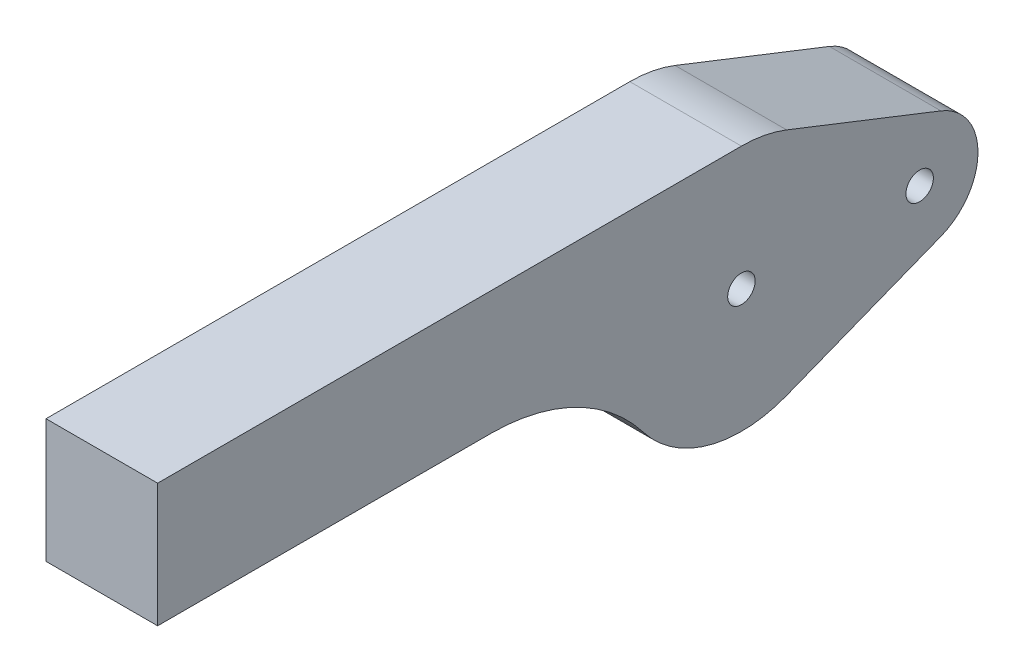
from build123d import *

# Parameters (mm, degrees)
EXTRUDE_1_DEPTH = 8.13
FILLET_1_R      = 14


with BuildPart() as part:
    # 草图1 → 凸台-拉伸1 (new body)
    with BuildSketch(Plane(origin=(0, 0, 0), x_dir=(0, 0, -1), z_dir=(1, 0, 0))):
        with BuildLine():
            Line((-30, 4.725), (4.860079961, 4.725))
            ThreePointArc((4.860079961, 4.725), (8.133942545, 7.858912138), (12.52, 9))
            Line((12.52, 9), (-30, 9))
            Line((-30, 9), (-30, 4.725))
        make_face()
        with BuildLine():
            ThreePointArc((12.52, 9), (8.133942545, 7.858912138), (4.860079961, 4.725))
            Line((4.860079961, 4.725), (20.179920039, 4.725))
            ThreePointArc((20.179920039, 4.725), (18.292906217, 6.904603813), (15.813528505, 8.375719073))
            ThreePointArc((15.813528505, 8.375719073), (14.196085968, 8.842552563), (12.52, 9))
        make_face()
        with BuildLine():
            ThreePointArc((11.52, 0), (12.52, 1), (13.52, 0))
            Line((13.52, 0), (21.25, 0))
            ThreePointArc((21.25, 0), (21.296353514, 0.625984202), (21.434402928, 1.238313549))
            ThreePointArc((21.434402928, 1.238313549), (20.988547163, 3.046917943), (20.179920039, 4.725))
            Line((20.179920039, 4.725), (4.860079961, 4.725))
            ThreePointArc((4.860079961, 4.725), (3.861498965, 2.455679097), (3.52, 0))
            Line((3.52, 0), (11.52, 0))
        make_face()
        with BuildLine():
            ThreePointArc((21.434402928, 1.238313549), (21.498575231, 0.620634213), (21.52, 0))
            Line((21.52, 0), (24.5, 0))
            ThreePointArc((24.5, 0), (25.5, 1), (26.5, 0))
            Line((26.5, 0), (29.75, 0))
            ThreePointArc((29.75, 0), (29.012294744, 2.392965865), (27.05527735, 3.955200673))
            ThreePointArc((27.05527735, 3.955200673), (23.650460817, 3.826448067), (21.434402928, 1.238313549))
        make_face()
        with BuildLine():
            Line((24.5, 0), (21.52, 0))
            ThreePointArc((21.52, 0), (21.498575231, -0.620634213), (21.434402928, -1.238313549))
            ThreePointArc((21.434402928, -1.238313549), (23.650460817, -3.826448067), (27.05527735, -3.955200673))
            ThreePointArc((27.05527735, -3.955200673), (29.012294744, -2.392965865), (29.75, 0))
            Line((29.75, 0), (26.5, 0))
            ThreePointArc((26.5, 0), (25.5, -1), (24.5, 0))
        make_face()
        with BuildLine():
            ThreePointArc((20.179920039, 4.725), (20.988547163, 3.046917943), (21.434402928, 1.238313549))
            ThreePointArc((21.434402928, 1.238313549), (23.650460817, 3.826448067), (27.05527735, 3.955200673))
            Line((27.05527735, 3.955200673), (25.097613132, 4.725))
            Line((25.097613132, 4.725), (20.179920039, 4.725))
        make_face()
        with BuildLine():
            ThreePointArc((15.813528505, 8.375719073), (18.292906217, 6.904603813), (20.179920039, 4.725))
            Line((20.179920039, 4.725), (25.097613132, 4.725))
            Line((25.097613132, 4.725), (15.813528505, 8.375719073))
        make_face()
        with BuildLine():
            Line((-30, 0), (3.52, 0))
            ThreePointArc((3.52, 0), (3.861498965, 2.455679097), (4.860079961, 4.725))
            Line((4.860079961, 4.725), (-30, 4.725))
            Line((-30, 4.725), (-30, 0))
        make_face()
        with BuildLine():
            Line((21.25, 0), (13.52, 0))
            ThreePointArc((13.52, 0), (12.52, -1), (11.52, 0))
            Line((11.52, 0), (3.52, 0))
            ThreePointArc((3.52, 0), (3.861498965, -2.455679097), (4.860079961, -4.725))
            Line((4.860079961, -4.725), (20.179920039, -4.725))
            ThreePointArc((20.179920039, -4.725), (20.988547163, -3.046917943), (21.434402928, -1.238313549))
            ThreePointArc((21.434402928, -1.238313549), (21.296353514, -0.625984202), (21.25, 0))
        make_face()
        with BuildLine():
            Line((20.179920039, -4.725), (4.860079961, -4.725))
            ThreePointArc((4.860079961, -4.725), (9.674252086, -8.538250336), (15.813528505, -8.375719073))
            ThreePointArc((15.813528505, -8.375719073), (18.292906217, -6.904603813), (20.179920039, -4.725))
        make_face()
        with BuildLine():
            ThreePointArc((27.05527735, -3.955200673), (23.650460817, -3.826448067), (21.434402928, -1.238313549))
            ThreePointArc((21.434402928, -1.238313549), (20.988547163, -3.046917943), (20.179920039, -4.725))
            Line((20.179920039, -4.725), (25.097613132, -4.725))
            Line((25.097613132, -4.725), (27.05527735, -3.955200673))
        make_face()
        with BuildLine():
            ThreePointArc((21.434402928, 1.238313549), (21.296353514, 0.625984202), (21.25, 0))
            Line((21.25, 0), (21.52, 0))
            ThreePointArc((21.52, 0), (21.498575231, 0.620634213), (21.434402928, 1.238313549))
        make_face()
        with BuildLine():
            Line((21.52, 0), (21.25, 0))
            ThreePointArc((21.25, 0), (21.296353514, -0.625984202), (21.434402928, -1.238313549))
            ThreePointArc((21.434402928, -1.238313549), (21.498575231, -0.620634213), (21.52, 0))
        make_face()
        with BuildLine():
            Line((25.097613132, -4.725), (20.179920039, -4.725))
            ThreePointArc((20.179920039, -4.725), (18.292906217, -6.904603813), (15.813528505, -8.375719073))
            Line((15.813528505, -8.375719073), (25.097613132, -4.725))
        make_face()
    extrude(amount=EXTRUDE_1_DEPTH)

    # 圆角1
    fillet_1_edges = [part.edges().sort_by_distance(p)[0] for p in [
        (4.065, 0, -3.52),
    ]]
    fillet(fillet_1_edges, radius=FILLET_1_R)


solid = part.part
